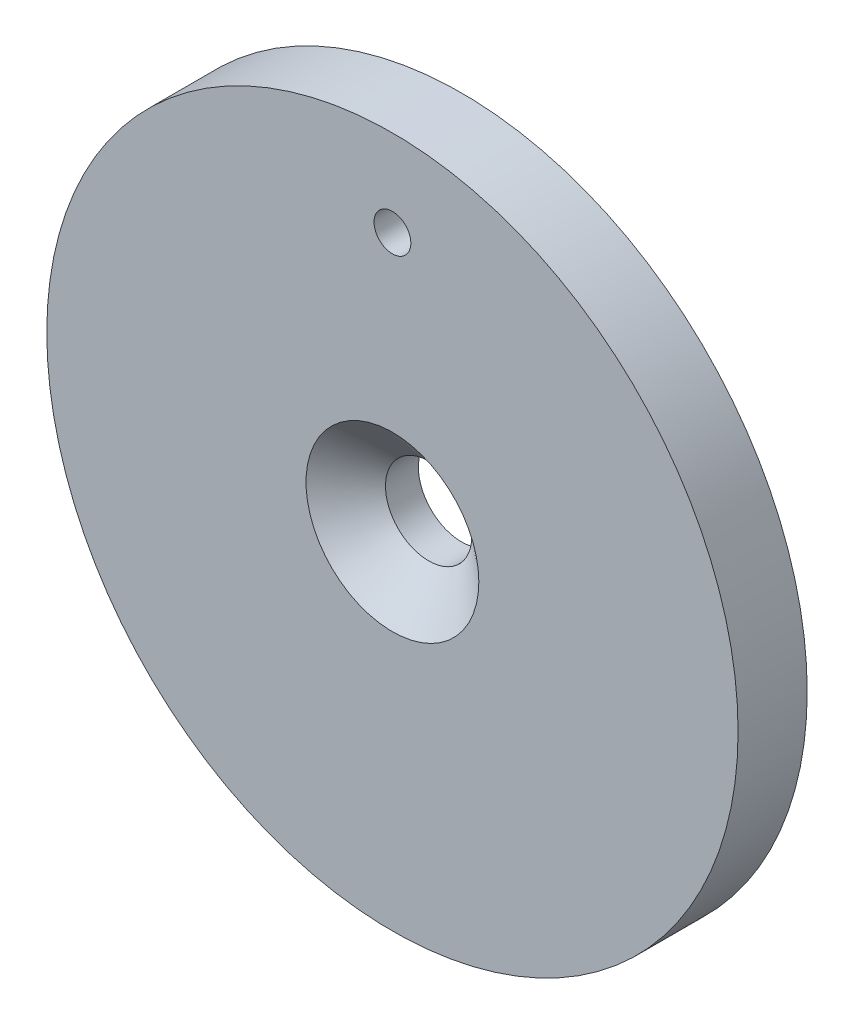
from build123d import *

# Parameters (mm, degrees)
SKETCH1_R             = 25.4
DISC_BASE_DEPTH       = 5.08
SKETCH2_R             = 3.175
CUT_EXTRUDE2_DEPTH    = 37.278456417
F_6_32_TAPPED_HOLE1_D = 2.7051


with BuildPart() as part:
    # Sketch1 → Disc Base (new body)
    with BuildSketch(Plane.XY):
        Circle(SKETCH1_R)
    extrude(amount=DISC_BASE_DEPTH)

    # Sketch10 → CSK for 1/4 Flat Head Machine Screw (100)1 (revolve, cut)
    with BuildSketch(Plane(origin=(0, 0, 5.08), x_dir=(0, -1, 0), z_dir=(1, 0, 0))):
        Polygon((0, 0), (0, 2.54), (3.175, 0.632267535), (3.175, 2.664141329), (6.35, 0), align=None)
    revolve(axis=Axis((0, 0, 11.43), (0, 0, -1)), mode=Mode.SUBTRACT)

    # Sketch2 → Cut-Extrude2 (cut, through all)
    with BuildSketch(Plane.XY.offset(5.08)):
        Circle(SKETCH2_R)
    extrude(amount=-CUT_EXTRUDE2_DEPTH, mode=Mode.SUBTRACT)

    # #6-32 Tapped Hole1 (through all)
    with Locations(Plane(origin=(0, 19.05, 5.08), x_dir=(1, 0, 0), z_dir=(0, 0, 1))):
        with Locations((0, 0)):
            Hole(F_6_32_TAPPED_HOLE1_D / 2)


solid = part.part
